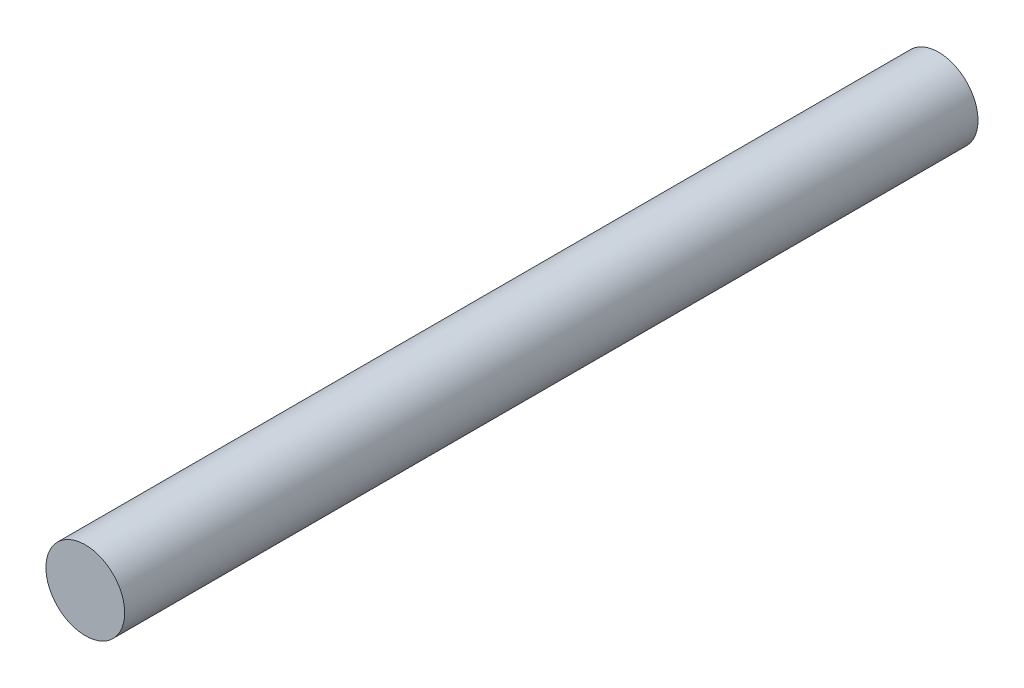
from build123d import *

# Parameters (mm, degrees)
SKETCH_1_R      = 1.5
EXTRUDE_1_DEPTH = 16.25


with BuildPart() as part:
    # 草图1 → 凸台-拉伸1 (new, symmetric)
    with BuildSketch(Plane.XY):
        Circle(SKETCH_1_R)
    extrude(amount=EXTRUDE_1_DEPTH, both=True)


solid = part.part
